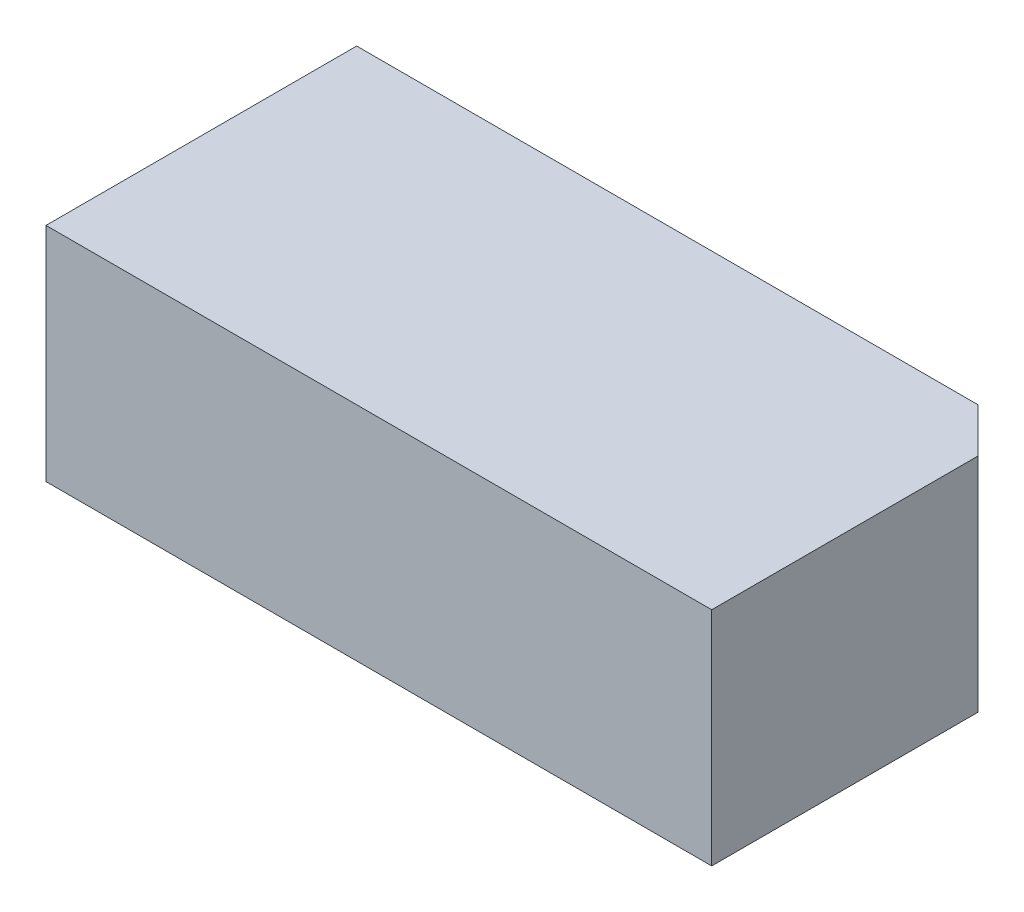
from build123d import *

# Parameters (mm, degrees)
SKETCH_1_W      = 15
SKETCH_1_H      = 5
EXTRUDE_1_DEPTH = 7
CHAMFER_1_SIZE  = 1


with BuildPart() as part:
    # 草图1 → 凸台-拉伸1 (new body)
    with BuildSketch(Plane.XY):
        with Locations((-5.977011494, 0.517241379)):
            Rectangle(SKETCH_1_W, SKETCH_1_H)
    extrude(amount=EXTRUDE_1_DEPTH)

    # 倒角1
    chamfer_1_edges = [part.edges().sort_by_distance(p)[0] for p in [
        (1.522988506, 0.517241379, 0),
    ]]
    chamfer(chamfer_1_edges, length=CHAMFER_1_SIZE)


solid = part.part
